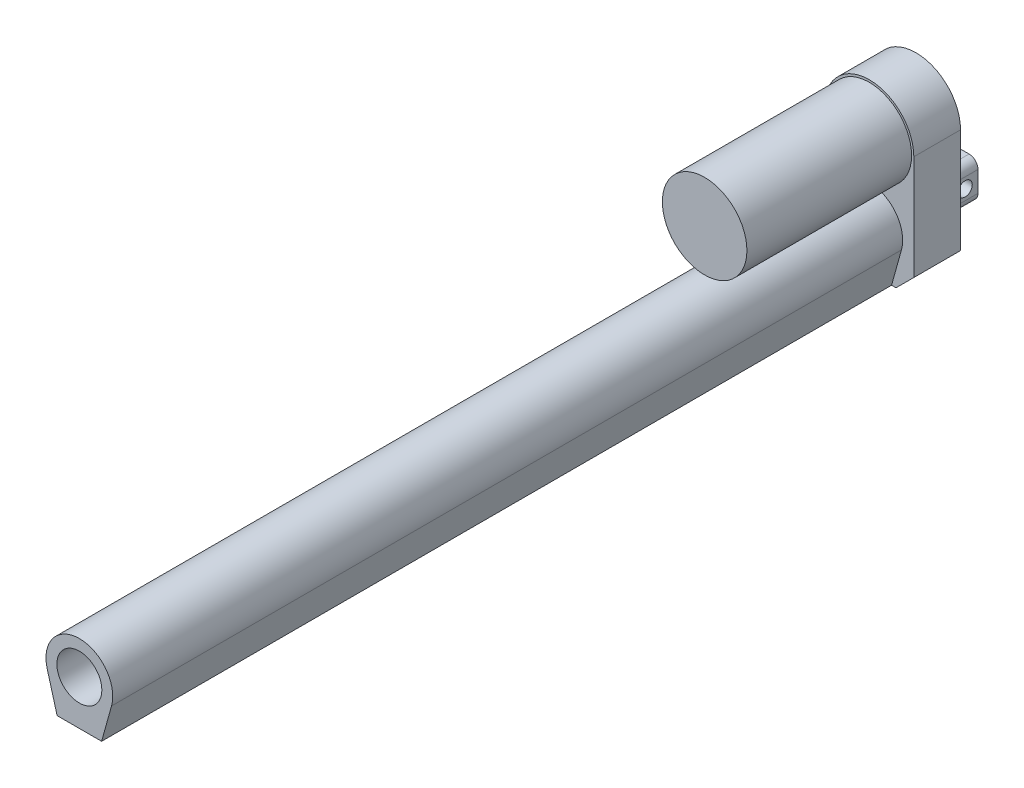
from build123d import *

# Parameters (mm, degrees)
BOSS_EXTRUDE1_DEPTH     = 21
SKETCH2_R               = 19
BOSS_EXTRUDE2_DEPTH     = 74
BOSS_EXTRUDE3_DEPTH     = 355
SKETCH4_W               = 17.3
SKETCH4_H               = 17.3
BOSS_EXTRUDE4_DEPTH     = 19.2
FILLET1_R               = 4
SKETCH5_R               = 10.1
CUT_EXTRUDE1_DEPTH      = 300
CUT_EXTRUDE2_DEPTH      = 379.394304925
CUT_EXTRUDE2_DEPTH_BACK = 379.394304925
SKETCH6_R               = 3.175


with BuildPart() as part:
    # Sketch1 → Boss-Extrude1 (new body)
    with BuildSketch(Plane.XY):
        with BuildLine():
            Line((-12, -37.5), (12, -37.5))
            Line((12, -37.5), (20, -29.5))
            Line((20, -29.5), (20, 17.5))
            ThreePointArc((20, 17.5), (0, 37.5), (-20, 17.5))
            Line((-20, 17.5), (-20, -29.5))
            Line((-20, -29.5), (-12, -37.5))
        make_face()
    extrude(amount=BOSS_EXTRUDE1_DEPTH)

    # Sketch2 → Boss-Extrude2 (add)
    with BuildSketch(Plane.XY.offset(21)):
        with Locations((0, 17.5)):
            Circle(SKETCH2_R)
    extrude(amount=BOSS_EXTRUDE2_DEPTH)

    # Sketch3 → Boss-Extrude3 (add)
    with BuildSketch(Plane.XY.offset(21)):
        with BuildLine():
            Line((14.449874371, -21.525062814), (10, -37.5))
            Line((10, -37.5), (-10, -37.5))
            Line((-10, -37.5), (-14.449874371, -21.525062814))
            ThreePointArc((-14.449874371, -21.525062814), (0, -2.5), (14.449874371, -21.525062814))
        make_face()
    extrude(amount=BOSS_EXTRUDE3_DEPTH)

    # Sketch4 → Boss-Extrude4 (add)
    with BuildSketch(Plane(origin=(0, 0, 0), x_dir=(-1, 0, 0), z_dir=(0, 0, -1))):
        with Locations((0, -17.85)):
            Rectangle(SKETCH4_W, SKETCH4_H)
    extrude(amount=BOSS_EXTRUDE4_DEPTH)

    # Fillet1
    fillet1_edges = [part.edges().sort_by_distance(p)[0] for p in [
        (-8.65, -26.5, -9.6),
        (-8.65, -9.2, -9.6),
        (8.65, -9.2, -9.6),
        (8.65, -26.5, -9.6),
    ]]
    fillet(fillet1_edges, radius=FILLET1_R)

    # Sketch5 → Cut-Extrude1 (cut)
    with BuildSketch(Plane.XY.offset(376)):
        with Locations((0, -17.5)):
            Circle(SKETCH5_R)
    extrude(amount=-CUT_EXTRUDE1_DEPTH, mode=Mode.SUBTRACT)

    # Sketch6 → Cut-Extrude2 (cut, two sides: drawn at the far end of the back side and taken through both)
    with BuildSketch(Plane(origin=(0, 0, 0), x_dir=(0, 0, -1), z_dir=(1, 0, 0)).offset(-CUT_EXTRUDE2_DEPTH_BACK)):
        with Locations((13.45, -17.85)):
            Circle(SKETCH6_R)
    extrude(amount=CUT_EXTRUDE2_DEPTH + CUT_EXTRUDE2_DEPTH_BACK, mode=Mode.SUBTRACT)


solid = part.part
